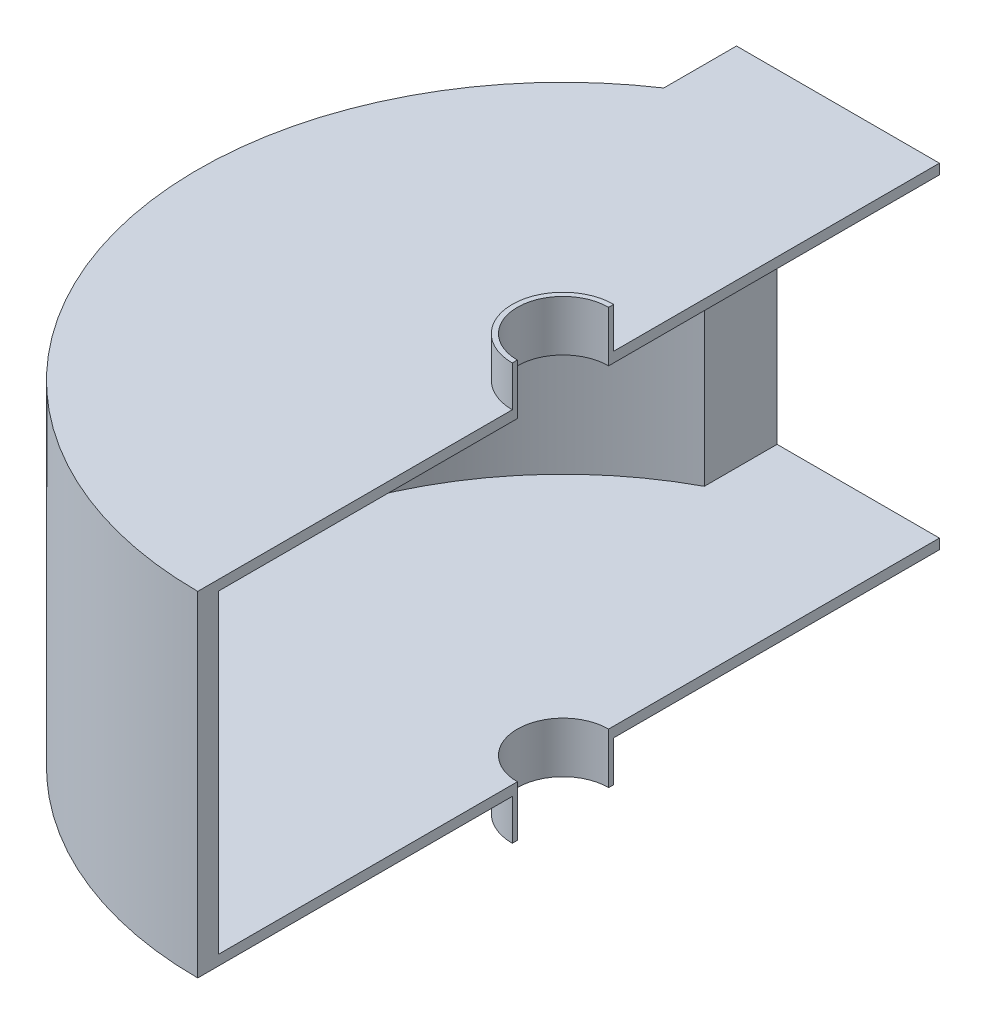
from build123d import *

# Parameters (mm, degrees)
BOSS_EXTRUDE1_DEPTH      = 20
BOSS_EXTRUDE1_DEPTH_BACK = 5
BOSS_EXTRUDE2_START      = -5
BOSS_EXTRUDE2_DEPTH      = 5
BOSS_EXTRUDE3_REACH      = 316.977


with BuildPart() as part:
    # Sketch1 → Boss-Extrude1 (new, two sides: drawn at the far end of the back side and taken through both)
    with BuildSketch(Plane(origin=(0, 0, 0), x_dir=(1, 0, 0), z_dir=(0, 1, 0)).offset(-BOSS_EXTRUDE1_DEPTH_BACK)):
        with BuildLine():
            Line((0, 25), (0, 22.5))
            ThreePointArc((0, 22.5), (-22.5, 0), (0, -22.5))
            Line((0, -22.5), (0, -25))
            ThreePointArc((0, -25), (-25, 0), (0, 25))
        make_face()
    extrude(amount=BOSS_EXTRUDE1_DEPTH + BOSS_EXTRUDE1_DEPTH_BACK)

    # Sketch2 → Boss-Extrude2 (add)
    with BuildSketch(Plane(origin=(0, 0, 0), x_dir=(1, 0, 0), z_dir=(0, 1, 0)).offset(BOSS_EXTRUDE2_START)):
        with BuildLine():
            Line((0, -25), (0, -180))
            ThreePointArc((0, -180), (-172.249721603, -52.249721603), (-100, 149.666295471))
            Line((-100, 149.666295471), (-100, 185.5))
            Line((-100, 185.5), (0, 185.5))
            Line((0, 185.5), (0, 25))
            ThreePointArc((0, 25), (-25, 0), (0, -25))
        make_face()
    extrude(amount=BOSS_EXTRUDE2_DEPTH)


with BuildPart() as body_2:
    # Mirror1: mirrored copy
    add(part.part.mirror(Plane.ZX.offset(-82.5)))

    # Sketch3 → Boss-Extrude3 (add, up to next)
    with BuildSketch(Plane.XZ.offset(5), mode=Mode.PRIVATE) as boss_extrude3_sk1:
        with BuildLine():
            Line((-100, -149.666295471), (-100, -185.5))
            Line((-100, -185.5), (-80, -185.5))
            Line((-80, -185.5), (-80, -149.666295471))
            ThreePointArc((-80, -149.666295471), (-164.619580528, 41.235830377), (0, 169.705627485))
            Line((0, 169.705627485), (0, 180))
            ThreePointArc((0, 180), (-172.249721603, 52.249721603), (-100, -149.666295471))
        make_face()
    boss_extrude3_tool1 = extrude(boss_extrude3_sk1.sketch, amount=BOSS_EXTRUDE3_REACH, mode=Mode.PRIVATE) - body_2.part

    add(part.part)  # Boss-Extrude3 merges part
    add(boss_extrude3_tool1.solids().sort_by_distance((-95.92581, -5, -167.583148))[0])


solid = body_2.part
